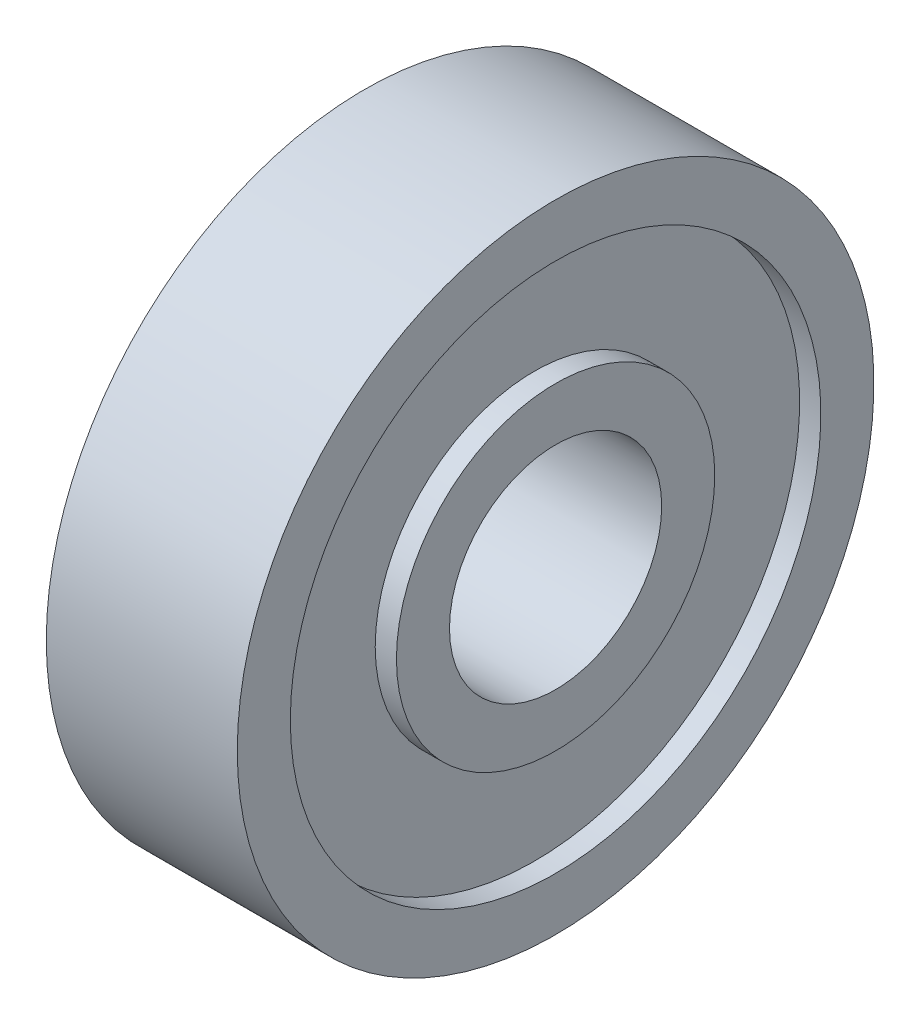
from build123d import *


with BuildPart() as part:
    # Sketch1 → Revolve1 (revolve)
    with BuildSketch(Plane.XY, mode=Mode.PRIVATE) as revolve1_sk:
        Polygon((0, 5), (4.5, 5), (4.5, 7.5), (3.5, 7.5), (3.5, 12.5), (4.5, 12.5), (4.5, 15), (0, 15), align=None)
    revolve1 = revolve(revolve1_sk.sketch.rotate(Axis((-243.027564124, 0, 0), (1, 0, 0)), 90), axis=Axis((-243.027564124, 0, 0), (1, 0, 0)))

    # Mirror1: Revolve1 across Right Plane
    add(revolve1.mirror(Plane(origin=(0, 0, 0), x_dir=(0, 0, -1), z_dir=(1, 0, 0))))


solid = part.part
